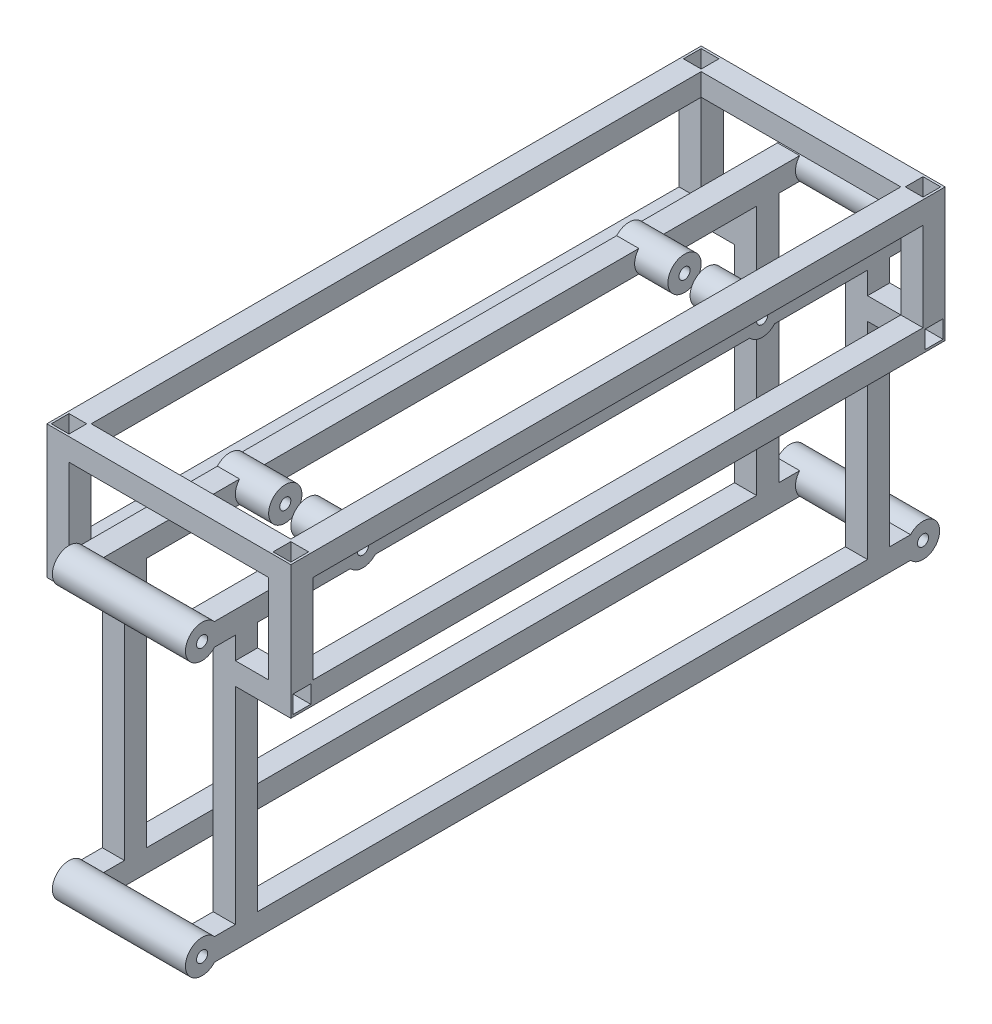
from build123d import *

# Parameters (mm, degrees)
SZKIC1_W                      = 20
SZKIC1_H                      = 20
SZKIC1_W_2                    = 16
SZKIC1_H_2                    = 16
DODANIE_WYCI_GNI_CIE1_DEPTH   = 325
DODANIE_WYCI_GNI_CIE1_2_DEPTH = 325
SZKIC3_R                      = 15
DODANIE_WYCI_GNI_CIE2_DEPTH   = 120
SZKIC4_R                      = 5
WYTNIJ_WYCI_GNI_CIE1_DEPTH    = 120
SZKIC5_W                      = 20
SZKIC5_H                      = 20
SZKIC5_W_2                    = 16
SZKIC5_H_2                    = 16
DODANIE_WYCI_GNI_CIE3_DEPTH   = 226
SZKIC6_W                      = 20
SZKIC6_H                      = 20
SZKIC6_W_2                    = 16
SZKIC6_H_2                    = 16
DODANIE_WYCI_GNI_CIE4_DEPTH   = 325
SZKIC7_R                      = 15
DODANIE_WYCI_GNI_CIE5_DEPTH   = 120
SZKIC8_R                      = 5
WYTNIJ_WYCI_GNI_CIE2_DEPTH    = 120
SZKIC9_R                      = 15
DODANIE_WYCI_GNI_CIE6_DEPTH   = 120
SZKIC10_R                     = 5
WYTNIJ_WYCI_GNI_CIE3_DEPTH    = 120
SZKIC11_W                     = 20
SZKIC11_H                     = 300
WYTNIJ_WYCI_GNI_CIE4_DEPTH    = 60
SZKIC12_R                     = 15
DODANIE_WYCI_GNI_CIE7_DEPTH   = 120
SZKIC13_R                     = 5
WYTNIJ_WYCI_GNI_CIE5_DEPTH    = 120
SZKIC14_W                     = 20
SZKIC14_H                     = 300
WYTNIJ_WYCI_GNI_CIE6_DEPTH    = 60
SZKIC15_W                     = 20
SZKIC15_H                     = 20
SZKIC15_W_2                   = 16
SZKIC15_H_2                   = 16
DODANIE_WYCI_GNI_CIE8_DEPTH   = 50
DODANIE_WYCI_GNI_CIE9_REACH   = 679.086
SZKIC16_W                     = 20
SZKIC16_H                     = 20
SZKIC16_W_2                   = 16
SZKIC16_H_2                   = 16
LUSTRO6_COPY_1_SKETCH_W       = 20
LUSTRO6_COPY_1_SKETCH_H       = 20
LUSTRO6_COPY_1_SKETCH_W_2     = 16
LUSTRO6_COPY_1_SKETCH_H_2     = 16
LUSTRO6_COPY_1_DEPTH          = 50
SZKIC17_W                     = 20
SZKIC17_H                     = 20
SZKIC17_W_2                   = 16
SZKIC17_H_2                   = 16
DODANIE_WYCI_GNI_CIE10_DEPTH  = 100
DODANIE_WYCI_GNI_CIE11_REACH  = 711.705
SZKIC19_W                     = 20
SZKIC19_H                     = 20
SZKIC19_W_2                   = 16
SZKIC19_H_2                   = 16
DODANIE_WYCI_GNI_CIE12_REACH  = 507.427
SZKIC20_W                     = 20
SZKIC20_H                     = 20
SZKIC20_W_2                   = 16
SZKIC20_H_2                   = 16


with BuildPart() as part:
    # Szkic1 → Dodanie-wyciągnięcie1 (new, symmetric)
    with BuildSketch(Plane.XY):
        Rectangle(SZKIC1_W, SZKIC1_H)
        Rectangle(SZKIC1_W_2, SZKIC1_H_2, mode=Mode.SUBTRACT)
    extrude(amount=DODANIE_WYCI_GNI_CIE1_DEPTH, both=True)



with BuildPart() as body_2:
    # Szkic1 → Dodanie-wyci_gni_cie1 2 (new, symmetric)
    with BuildSketch(Plane.XY):
        with Locations((-100, 0)):
            Rectangle(SZKIC1_W, SZKIC1_H)
        with Locations((-100, 0)):
            Rectangle(SZKIC1_W_2, SZKIC1_H_2, mode=Mode.SUBTRACT)
    extrude(amount=DODANIE_WYCI_GNI_CIE1_2_DEPTH, both=True)


with BuildPart() as part_1:
    add(part.part)

    add(body_2.part)  # Dodanie-wyciągnięcie2 merges body 2
    # Szkic3 → Dodanie-wyciągnięcie2 (add)
    with BuildSketch(Plane(origin=(10, 0, 0), x_dir=(0, 0, -1), z_dir=(1, 0, 0))):
        with Locations(Location((-325, 0, 0), (0, 0, 41.810314896))):
            Circle(SZKIC3_R)
    dodanie_wyci_gni_cie2 = extrude(amount=-DODANIE_WYCI_GNI_CIE2_DEPTH)

    # Szkic4 → Wytnij-wyciągnięcie1 (cut)
    with BuildSketch(Plane(origin=(10, 0, 0), x_dir=(0, 0, -1), z_dir=(1, 0, 0))):
        with Locations((-325, 0)):
            Circle(SZKIC4_R)
    wytnij_wyci_gni_cie1 = extrude(amount=-WYTNIJ_WYCI_GNI_CIE1_DEPTH, mode=Mode.SUBTRACT)

    # Lustro1: Dodanie-wyciągnięcie2, Wytnij-wyciągnięcie1 across plane
    add(dodanie_wyci_gni_cie2.mirror(Plane.XY))
    add(wytnij_wyci_gni_cie1.mirror(Plane.XY), mode=Mode.SUBTRACT)

    # Szkic5 → Dodanie-wyciągnięcie3 (add)
    # profile 1 of 2: a face of its own
    with BuildSketch(Plane(origin=(0, 10, 0), x_dir=(1, 0, 0), z_dir=(0, 1, 0))):
        with Locations((0, -285)):
            Rectangle(SZKIC5_W, SZKIC5_H)
        with Locations((0, -285)):
            Rectangle(SZKIC5_W_2, SZKIC5_H_2, mode=Mode.SUBTRACT)
    # profile 2 of 2: a face of its own
    with BuildSketch(Plane(origin=(0, 10, 0), x_dir=(1, 0, 0), z_dir=(0, 1, 0))):
        with Locations((-100, -285)):
            Rectangle(SZKIC5_W, SZKIC5_H)
        with Locations((-100, -285)):
            Rectangle(SZKIC5_W_2, SZKIC5_H_2, mode=Mode.SUBTRACT)
    dodanie_wyci_gni_cie3 = extrude(amount=DODANIE_WYCI_GNI_CIE3_DEPTH)

    # Lustro2: Dodanie-wyciągnięcie3 across plane
    add(dodanie_wyci_gni_cie3.mirror(Plane.XY))

    # Szkic6 → Dodanie-wyciągnięcie4 (add, symmetric)
    # profile 1 of 2: a face of its own
    with BuildSketch(Plane.XY):
        with Locations((0, 246)):
            Rectangle(SZKIC6_W, SZKIC6_H)
        with Locations((0, 246)):
            Rectangle(SZKIC6_W_2, SZKIC6_H_2, mode=Mode.SUBTRACT)
    # profile 2 of 2: a face of its own
    with BuildSketch(Plane.XY):
        with Locations((-100, 246)):
            Rectangle(SZKIC6_W, SZKIC6_H)
        with Locations((-100, 246)):
            Rectangle(SZKIC6_W_2, SZKIC6_H_2, mode=Mode.SUBTRACT)
    extrude(amount=DODANIE_WYCI_GNI_CIE4_DEPTH, both=True)

    # Szkic7 → Dodanie-wyciągnięcie5 (add)
    with BuildSketch(Plane(origin=(10, 0, 0), x_dir=(0, 0, -1), z_dir=(1, 0, 0))):
        with Locations(Location((-325, 246, 0), (0, 0, 41.810314896))):
            Circle(SZKIC7_R)
    dodanie_wyci_gni_cie5 = extrude(amount=-DODANIE_WYCI_GNI_CIE5_DEPTH)

    # Szkic8 → Wytnij-wyciągnięcie2 (cut)
    with BuildSketch(Plane(origin=(10, 0, 0), x_dir=(0, 0, -1), z_dir=(1, 0, 0))):
        with Locations((-325, 246)):
            Circle(SZKIC8_R)
    wytnij_wyci_gni_cie2 = extrude(amount=-WYTNIJ_WYCI_GNI_CIE2_DEPTH, mode=Mode.SUBTRACT)

    # Lustro4: Dodanie-wyciągnięcie5, Wytnij-wyciągnięcie2 across plane
    add(dodanie_wyci_gni_cie5.mirror(Plane.XY))
    add(wytnij_wyci_gni_cie2.mirror(Plane.XY), mode=Mode.SUBTRACT)

    # Szkic9 → Dodanie-wyciągnięcie6 (add)
    with BuildSketch(Plane(origin=(10, 0, 0), x_dir=(0, 0, -1), z_dir=(1, 0, 0))):
        with Locations(Location((-180, 246, 0), (0, 0, 318.189685104))):
            Circle(SZKIC9_R)
    extrude(amount=-DODANIE_WYCI_GNI_CIE6_DEPTH)

    # Szkic10 → Wytnij-wyciągnięcie3 (cut)
    with BuildSketch(Plane(origin=(10, 0, 0), x_dir=(0, 0, -1), z_dir=(1, 0, 0))):
        with Locations((-180, 246)):
            Circle(SZKIC10_R)
    extrude(amount=-WYTNIJ_WYCI_GNI_CIE3_DEPTH, mode=Mode.SUBTRACT)

    # Szkic11 → Wytnij-wyciągnięcie4 (cut, symmetric)
    with BuildSketch(Plane(origin=(0, 256, 0), x_dir=(1, 0, 0), z_dir=(0, 1, 0))):
        with Locations((-50, -150)):
            Rectangle(SZKIC11_W, SZKIC11_H)
    extrude(amount=WYTNIJ_WYCI_GNI_CIE4_DEPTH, both=True, mode=Mode.SUBTRACT)

    # Szkic12 → Dodanie-wyciągnięcie7 (add)
    with BuildSketch(Plane(origin=(10, 0, 0), x_dir=(0, 0, -1), z_dir=(1, 0, 0))):
        with Locations(Location((180, 246, 0), (0, 0, 318.189685104))):
            Circle(SZKIC12_R)
    extrude(amount=-DODANIE_WYCI_GNI_CIE7_DEPTH)

    # Szkic13 → Wytnij-wyciągnięcie5 (cut)
    with BuildSketch(Plane(origin=(10, 0, 0), x_dir=(0, 0, -1), z_dir=(1, 0, 0))):
        with Locations((180, 246)):
            Circle(SZKIC13_R)
    extrude(amount=-WYTNIJ_WYCI_GNI_CIE5_DEPTH, mode=Mode.SUBTRACT)

    # Szkic14 → Wytnij-wyciągnięcie6 (cut, symmetric)
    with BuildSketch(Plane(origin=(0, 256, 0), x_dir=(1, 0, 0), z_dir=(0, 1, 0))):
        with Locations((-50, 150)):
            Rectangle(SZKIC14_W, SZKIC14_H)
    extrude(amount=WYTNIJ_WYCI_GNI_CIE6_DEPTH, both=True, mode=Mode.SUBTRACT)

    # Szkic15 → Dodanie-wyciągnięcie8 (add)
    with BuildSketch(Plane(origin=(10, 0, 0), x_dir=(0, 0, -1), z_dir=(1, 0, 0))):
        with Locations((285, 206)):
            Rectangle(SZKIC15_W, SZKIC15_H)
        with Locations((285, 206)):
            Rectangle(SZKIC15_W_2, SZKIC15_H_2, mode=Mode.SUBTRACT)
    dodanie_wyci_gni_cie8 = extrude(amount=DODANIE_WYCI_GNI_CIE8_DEPTH)

    # Lustro5: Dodanie-wyciągnięcie8 across plane
    add(dodanie_wyci_gni_cie8.mirror(Plane.XY))

    # Szkic16 → Dodanie-wyciągnięcie9 (add, up to next)
    with BuildSketch(Plane.XY.offset(-275), mode=Mode.PRIVATE) as dodanie_wyci_gni_cie9_sk1:
        with Locations((50, 206)):
            Rectangle(SZKIC16_W, SZKIC16_H)
        with Locations((50, 206)):
            Rectangle(SZKIC16_W_2, SZKIC16_H_2, mode=Mode.SUBTRACT)
    dodanie_wyci_gni_cie9_tool1 = extrude(dodanie_wyci_gni_cie9_sk1.sketch, amount=DODANIE_WYCI_GNI_CIE9_REACH, mode=Mode.PRIVATE) - part_1.part
    dodanie_wyci_gni_cie9 = dodanie_wyci_gni_cie9_tool1.solids().sort_by_distance((50, 215.717157, -275))[0]
    add(dodanie_wyci_gni_cie9)

    # Lustro6: Dodanie-wyciągnięcie8, Dodanie-wyciągnięcie9 across plane
    add(dodanie_wyci_gni_cie8.mirror(Plane(origin=(-50, 0, 0), x_dir=(0, 0, 1), z_dir=(1, 0, 0))))
    add(dodanie_wyci_gni_cie9.mirror(Plane(origin=(-50, 0, 0), x_dir=(0, 0, 1), z_dir=(1, 0, 0))))

    # Lustro6 copy 1 sketch → Lustro6 copy 1 (add)
    with BuildSketch(Plane.ZY.offset(110)):
        with Locations((285, 206)):
            Rectangle(LUSTRO6_COPY_1_SKETCH_W, LUSTRO6_COPY_1_SKETCH_H)
        with Locations((285, 206)):
            Rectangle(LUSTRO6_COPY_1_SKETCH_W_2, LUSTRO6_COPY_1_SKETCH_H_2, mode=Mode.SUBTRACT)
    extrude(amount=LUSTRO6_COPY_1_DEPTH)

    # Szkic17 → Dodanie-wyciągnięcie10 (add)
    # profile 1 of 4: a face of its own
    with BuildSketch(Plane(origin=(0, 216, 0), x_dir=(1, 0, 0), z_dir=(0, 1, 0))):
        with Locations((50, 285)):
            Rectangle(SZKIC17_W, SZKIC17_H)
        with Locations((50, 285)):
            Rectangle(SZKIC17_W_2, SZKIC17_H_2, mode=Mode.SUBTRACT)
    # profile 2 of 4: a face of its own
    with BuildSketch(Plane(origin=(0, 216, 0), x_dir=(1, 0, 0), z_dir=(0, 1, 0))):
        with Locations((50, -285)):
            Rectangle(SZKIC17_W, SZKIC17_H)
        with Locations((50, -285)):
            Rectangle(SZKIC17_W_2, SZKIC17_H_2, mode=Mode.SUBTRACT)
    # profile 3 of 4: a face of its own
    with BuildSketch(Plane(origin=(0, 216, 0), x_dir=(1, 0, 0), z_dir=(0, 1, 0))):
        with Locations((-150, 285)):
            Rectangle(SZKIC17_W, SZKIC17_H)
        with Locations((-150, 285)):
            Rectangle(SZKIC17_W_2, SZKIC17_H_2, mode=Mode.SUBTRACT)
    # profile 4 of 4: a face of its own
    with BuildSketch(Plane(origin=(0, 216, 0), x_dir=(1, 0, 0), z_dir=(0, 1, 0))):
        with Locations((-150, -285)):
            Rectangle(SZKIC17_W, SZKIC17_H)
        with Locations((-150, -285)):
            Rectangle(SZKIC17_W_2, SZKIC17_H_2, mode=Mode.SUBTRACT)
    extrude(amount=DODANIE_WYCI_GNI_CIE10_DEPTH)

    # Szkic19 → Dodanie-wyciągnięcie11 (add, up to next)
    with BuildSketch(Plane(origin=(0, 0, 275), x_dir=(-1, 0, 0), z_dir=(0, 0, -1)), mode=Mode.PRIVATE) as dodanie_wyci_gni_cie11_sk1:
        with Locations((150, 306)):
            Rectangle(SZKIC19_W, SZKIC19_H)
        with Locations((150, 306)):
            Rectangle(SZKIC19_W_2, SZKIC19_H_2, mode=Mode.SUBTRACT)
    dodanie_wyci_gni_cie11_tool1 = extrude(dodanie_wyci_gni_cie11_sk1.sketch, amount=DODANIE_WYCI_GNI_CIE11_REACH, mode=Mode.PRIVATE) - part_1.part
    dodanie_wyci_gni_cie11 = dodanie_wyci_gni_cie11_tool1.solids().sort_by_distance((-150, 315.717157, 275))[0]
    add(dodanie_wyci_gni_cie11)

    # Lustro7: Dodanie-wyciągnięcie11 across plane
    add(dodanie_wyci_gni_cie11.mirror(Plane(origin=(-50, 0, 0), x_dir=(0, 0, 1), z_dir=(1, 0, 0))))

    # Szkic20 → Dodanie-wyciągnięcie12 (add, up to next)
    with BuildSketch(Plane(origin=(-140, 0, 0), x_dir=(0, 0, -1), z_dir=(1, 0, 0)), mode=Mode.PRIVATE) as dodanie_wyci_gni_cie12_sk1:
        with Locations((285, 306)):
            Rectangle(SZKIC20_W, SZKIC20_H)
        with Locations((285, 306)):
            Rectangle(SZKIC20_W_2, SZKIC20_H_2, mode=Mode.SUBTRACT)
    dodanie_wyci_gni_cie12_tool1 = extrude(dodanie_wyci_gni_cie12_sk1.sketch, amount=DODANIE_WYCI_GNI_CIE12_REACH, mode=Mode.PRIVATE) - part_1.part
    dodanie_wyci_gni_cie12 = dodanie_wyci_gni_cie12_tool1.solids().sort_by_distance((-140, 315.717157, -285))[0]
    add(dodanie_wyci_gni_cie12)

    # Lustro8: Dodanie-wyciągnięcie12 across plane
    add(dodanie_wyci_gni_cie12.mirror(Plane.XY))


solid = part_1.part
